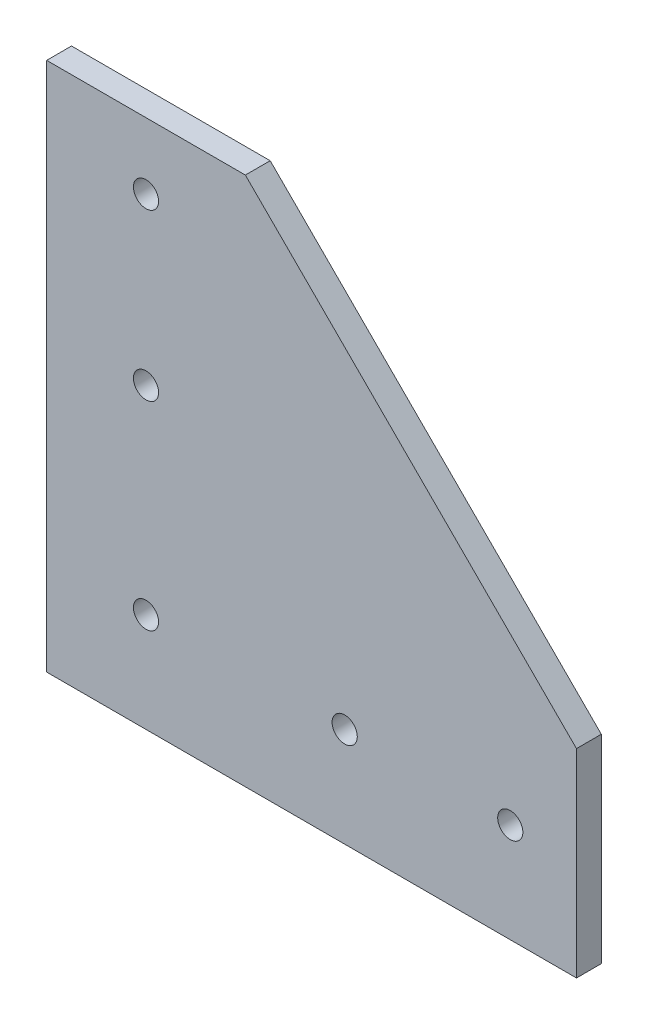
from build123d import *

# Parameters (mm, degrees)
SKETCH1_R           = 2.413
BOSS_EXTRUDE1_DEPTH = 4.7625


with BuildPart() as part:
    # Sketch1 → Boss-Extrude1 (new body)
    with BuildSketch(Plane.XY):
        Polygon((101.6, 38.1), (38.1, 101.6), (0, 101.6), (0, 0), (101.6, 0), align=None)
        with Locations(Location((19.05, 19.05, 0), (0, 0, 180))):
            Circle(SKETCH1_R, mode=Mode.SUBTRACT)
        with Locations(Location((57.15, 19.05, 0), (0, 0, 180))):
            Circle(SKETCH1_R, mode=Mode.SUBTRACT)
        with Locations(Location((88.9, 19.05, 0), (0, 0, 180))):
            Circle(SKETCH1_R, mode=Mode.SUBTRACT)
        with Locations(Location((19.05, 57.15, 0), (0, 0, 180))):
            Circle(SKETCH1_R, mode=Mode.SUBTRACT)
        with Locations(Location((19.05, 88.9, 0), (0, 0, 180))):
            Circle(SKETCH1_R, mode=Mode.SUBTRACT)
    extrude(amount=BOSS_EXTRUDE1_DEPTH)


solid = part.part
